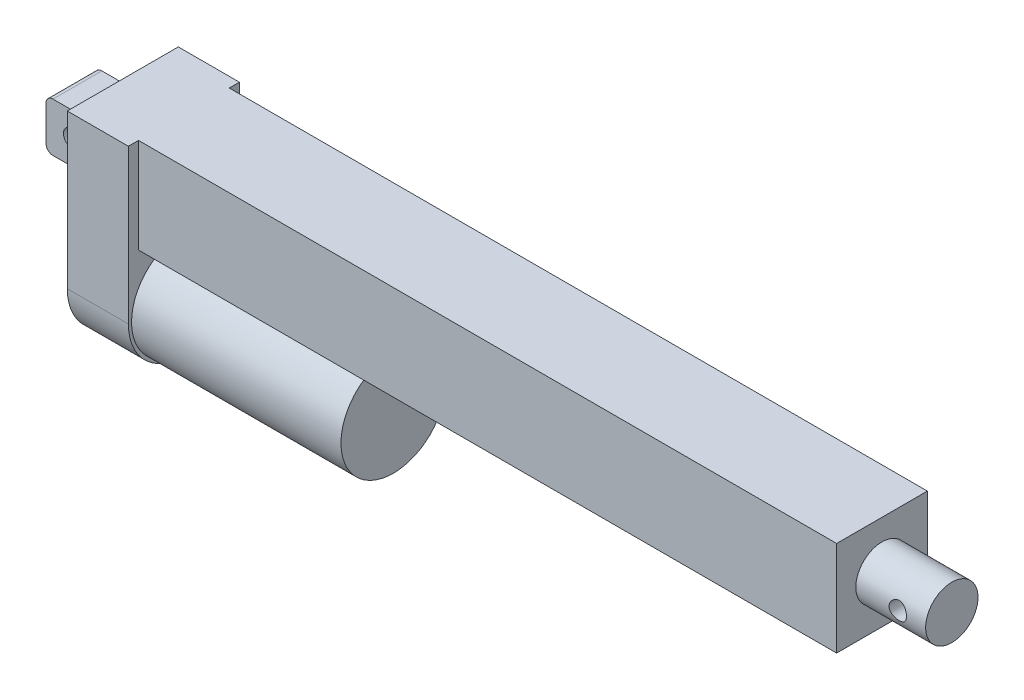
from build123d import *

# Parameters (mm, degrees)
SKETCH1_R               = 9.525
BOSS_EXTRUDE1_DEPTH     = 25.4
CUT_EXTRUDE1_DEPTH      = 29.750847814
CUT_EXTRUDE1_DEPTH_BACK = 29.750847814
SKETCH2_R               = 3.175
SKETCH3_W               = 33.02
SKETCH3_H               = 34.544
BOSS_EXTRUDE2_DEPTH     = 254
BOSS_EXTRUDE3_DEPTH     = 22.225
SKETCH5_R               = 19.05
BOSS_EXTRUDE4_DEPTH     = 76.2
SKETCH6_W               = 19.05
SKETCH6_H               = 17.78
SKETCH6_R               = 3.175
BOSS_EXTRUDE5_DEPTH     = 8.89
FILLET1_R               = 2.54


with BuildPart() as part:
    # Sketch1 → Boss-Extrude1 (new body)
    with BuildSketch(Plane(origin=(0, 0, 0), x_dir=(0, 0, -1), z_dir=(1, 0, 0))):
        Circle(SKETCH1_R)
    extrude(amount=BOSS_EXTRUDE1_DEPTH)

    # Sketch2 → Cut-Extrude1 (cut, two sides: drawn at the far end of the back side and taken through both)
    with BuildSketch(Plane.XY.offset(-CUT_EXTRUDE1_DEPTH_BACK)):
        with Locations((15.24, 0)):
            Circle(SKETCH2_R)
    extrude(amount=CUT_EXTRUDE1_DEPTH + CUT_EXTRUDE1_DEPTH_BACK, mode=Mode.SUBTRACT)

    # Sketch3 → Boss-Extrude2 (add)
    with BuildSketch(Plane.ZY):
        Rectangle(SKETCH3_W, SKETCH3_H)
    extrude(amount=BOSS_EXTRUDE2_DEPTH)

    # Sketch4 → Boss-Extrude3 (add)
    with BuildSketch(Plane.ZY.offset(254)):
        with BuildLine():
            Line((-20.193, 17.272), (20.193, 17.272))
            Line((20.193, 17.272), (20.193, -38.735))
            ThreePointArc((20.193, -38.735), (0, -58.928), (-20.193, -38.735))
            Line((-20.193, -38.735), (-20.193, 17.272))
        make_face()
    extrude(amount=BOSS_EXTRUDE3_DEPTH)

    # Sketch5 → Boss-Extrude4 (add)
    with BuildSketch(Plane(origin=(-254, 0, 0), x_dir=(0, 0, -1), z_dir=(1, 0, 0))):
        with Locations(Location((0, -38.735, 0), (0, 0, 180))):
            Circle(SKETCH5_R)
    extrude(amount=BOSS_EXTRUDE4_DEPTH)

    # Sketch6 → Boss-Extrude5 (add, symmetric)
    with BuildSketch(Plane.XY):
        with Locations((-285.75, -1.778)):
            Rectangle(SKETCH6_W, SKETCH6_H)
        with Locations((-285.75, -1.778)):
            Circle(SKETCH6_R, mode=Mode.SUBTRACT)
    extrude(amount=BOSS_EXTRUDE5_DEPTH, both=True)

    # Fillet1
    fillet1_edges = [part.edges().sort_by_distance(p)[0] for p in [
        (-276.225, -1.778, 8.89),
        (-276.225, -1.778, -8.89),
        (-276.225, -10.668, 0),
        (-276.225, 7.112, 0),
        (-295.275, 7.112, 0),
        (-295.275, -10.668, 0),
    ]]
    fillet(fillet1_edges, radius=FILLET1_R)


solid = part.part
